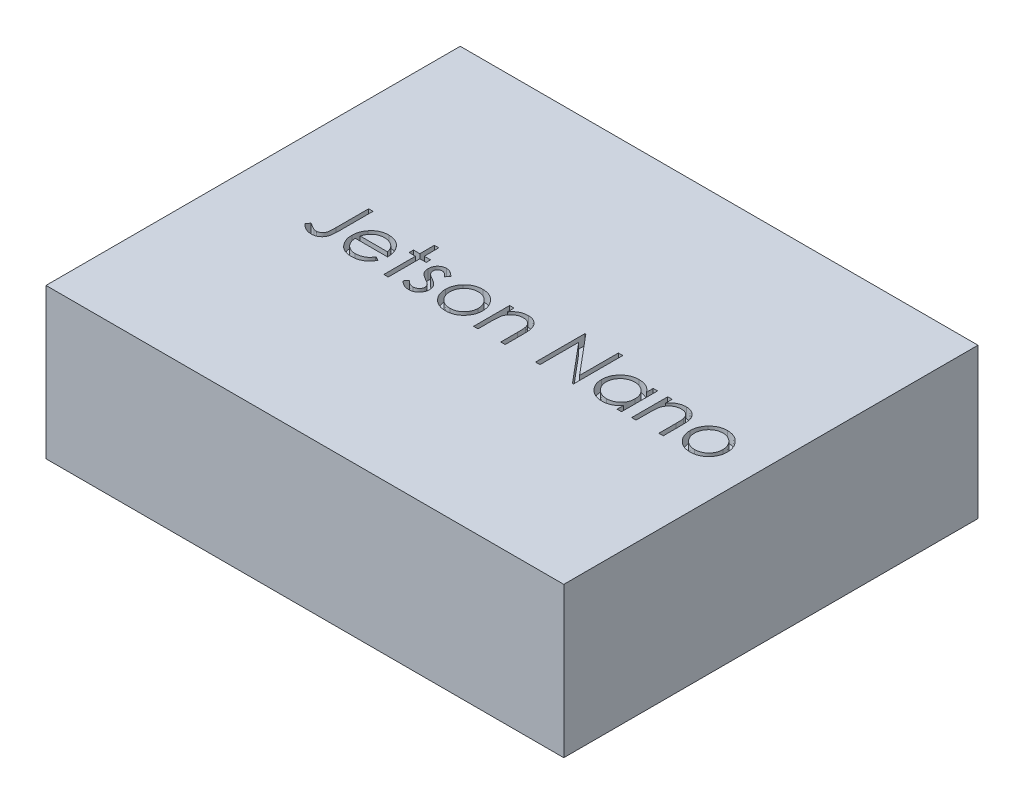
from build123d import *

# Parameters (mm, degrees)
SKETCH1_W           = 100
SKETCH1_H           = 80
BOSS_EXTRUDE1_DEPTH = 29
CUT_EXTRUDE1_DEPTH  = 2


with BuildPart() as part:
    # Sketch1 → Boss-Extrude1 (new body)
    with BuildSketch(Plane(origin=(0, 0, 0), x_dir=(1, 0, 0), z_dir=(0, 1, 0))):
        Rectangle(SKETCH1_W, SKETCH1_H)
    extrude(amount=BOSS_EXTRUDE1_DEPTH)

    # Sketch2 → Cut-Extrude1 (cut)
    # profile 1 of 10: a face of its own
    with BuildSketch(Plane(origin=(0, 29, 0), x_dir=(1, 0, 0), z_dir=(0, 1, 0))):
        with BuildLine():
            Line((-31.665248514, 3.974314492), (-30.810440822, 3.974314492))
            Line((-30.810440822, 3.974314492), (-30.810440822, -2.457731782))
            add(Edge.make_bspline(
                [(-30.810440822, -2.457731782), (-30.811295129, -2.576672283), (-30.812935503, -2.805052558), (-30.821955434, -3.134002232), (-30.838647256, -3.434368171), (-30.862963254, -3.706833373), (-30.895403317, -3.950544255), (-30.9325264, -4.167383922), (-30.977464803, -4.355542629), (-31.045137115, -4.566821705), (-31.156100503, -4.798534487), (-31.323106514, -5.048783862), (-31.530568624, -5.267677643), (-31.770873579, -5.457776845), (-32.046121652, -5.609244024), (-32.350644662, -5.717979188), (-32.682568018, -5.784302734), (-32.912798732, -5.791307432), (-33.031414379, -5.794916277)],
                knots=[0, 0, 0, 0, 1.237770943, 2.376671248, 3.424123796, 4.367912054, 5.222547132, 5.982086412, 6.656319012, 7.234008312, 8.288027371, 9.317870876, 10.352700517, 11.413286737, 12.494591526, 13.606319346, 14.766767577, 16, 16, 16, 16], degree=3))
            add(Edge.make_bspline(
                [(-33.031414379, -5.794916277), (-33.123829626, -5.791975477), (-33.309775222, -5.786058391), (-33.586519223, -5.737830015), (-33.862477457, -5.663491354), (-34.139114614, -5.554627148), (-34.421896192, -5.406566198), (-34.714652093, -5.212841804), (-35.021148063, -4.973814579), (-35.223032577, -4.791376142), (-35.328710052, -4.695877816)],
                knots=[0, 0, 0, 0, 0.848567217, 1.707373443, 2.573483905, 3.470863513, 4.432650262, 5.500696352, 6.691726801, 8, 8, 8, 8], degree=3))
            Line((-35.328710052, -4.695877816), (-34.824984091, -3.963185508))
            add(Edge.make_bspline(
                [(-34.824984091, -3.963185508), (-34.7087718, -4.043324493), (-34.489347842, -4.194637347), (-34.166846471, -4.389291881), (-33.881104219, -4.556183939), (-33.694188483, -4.641234784), (-33.60764635, -4.680613393)],
                knots=[0, 0, 0, 0, 1.196737151, 2.259595785, 3.194191475, 4, 4, 4, 4], degree=3))
            add(Edge.make_bspline(
                [(-33.60764635, -4.680613393), (-33.555165474, -4.701185916), (-33.452238789, -4.741533215), (-33.294871965, -4.786561695), (-33.138403328, -4.811169968), (-33.034668747, -4.815745596), (-32.983713057, -4.8179932)],
                knots=[0, 0, 0, 0, 1.051806502, 2.062826769, 3.048436908, 4, 4, 4, 4], degree=3))
            add(Edge.make_bspline(
                [(-32.983713057, -4.8179932), (-32.917901326, -4.8152099), (-32.787815798, -4.809708342), (-32.5987745, -4.761132814), (-32.417913715, -4.686989118), (-32.251717004, -4.578427811), (-32.098540344, -4.449346588), (-31.972149511, -4.293256307), (-31.866783296, -4.120266022), (-31.803374845, -3.956513708), (-31.762975858, -3.807170879), (-31.737335573, -3.669920702), (-31.714914648, -3.509461249), (-31.695370567, -3.32560099), (-31.683928401, -3.117971823), (-31.67109068, -2.887183405), (-31.666449934, -2.632653873), (-31.665661207, -2.455186925), (-31.665248514, -2.362329138)],
                knots=[0, 0, 0, 0, 0.997221856, 1.971139923, 2.944579524, 3.951425367, 4.971190333, 5.972282193, 6.985401279, 8.033996657, 8.624075553, 9.332086008, 10.151144245, 11.082816738, 12.137127781, 13.306538797, 14.590673636, 16, 16, 16, 16], degree=3))
            Line((-31.665248514, -2.362329138), (-31.665248514, 3.974314492))
        make_face()
    # profile 2 of 10: a face of its own
    with BuildSketch(Plane(origin=(0, 29, 0), x_dir=(1, 0, 0), z_dir=(0, 1, 0))):
        with BuildLine():
            Line((-22.899653562, -3.352608585), (-22.140248514, -3.751391638))
            add(Edge.make_bspline(
                [(-22.140248514, -3.751391638), (-22.20076382, -3.858733846), (-22.31850264, -4.067579276), (-22.520978961, -4.354504554), (-22.733228815, -4.612625837), (-22.964833186, -4.835047254), (-23.208862812, -5.028952809), (-23.466670965, -5.198600746), (-23.739599819, -5.343159005), (-24.027662284, -5.464949813), (-24.333277492, -5.558592793), (-24.657186047, -5.624734994), (-25.000008474, -5.665619747), (-25.234993435, -5.670369023), (-25.355317624, -5.672800893)],
                knots=[0, 0, 0, 0, 1.120438281, 2.179929193, 3.190490725, 4.156257408, 5.095198341, 6.022838206, 6.959905092, 7.901321166, 8.864066838, 9.862729781, 10.905609505, 12, 12, 12, 12], degree=3))
            add(Edge.make_bspline(
                [(-25.355317624, -5.672800893), (-25.489054006, -5.669678937), (-25.749934943, -5.663588906), (-26.129682398, -5.611085842), (-26.487222101, -5.525436066), (-26.822533951, -5.405786985), (-27.134796795, -5.249502624), (-27.424631264, -5.059112892), (-27.693561545, -4.835595827), (-27.933113143, -4.577015363), (-28.14876971, -4.300295179), (-28.339067834, -4.011943808), (-28.498155557, -3.712686747), (-28.627566589, -3.404429107), (-28.732082686, -3.089113796), (-28.804926359, -2.763871874), (-28.846917316, -2.429583605), (-28.853351985, -2.203440142), (-28.856594668, -2.089477575)],
                knots=[0, 0, 0, 0, 1.145258523, 2.234067595, 3.276747158, 4.290159414, 5.277019952, 6.260822364, 7.254936242, 8.264827045, 9.274100331, 10.257902744, 11.220704747, 12.172965371, 13.118907548, 14.062713208, 15.023725156, 16, 16, 16, 16], degree=3))
            add(Edge.make_bspline(
                [(-28.856594668, -2.089477575), (-28.85371229, -1.982539501), (-28.847999799, -1.77060236), (-28.811993156, -1.456915414), (-28.748180301, -1.152037982), (-28.660614734, -0.855716735), (-28.547535985, -0.568447813), (-28.409199732, -0.290056383), (-28.245390475, -0.02083868), (-28.118918413, 0.148986991), (-28.055212456, 0.234530838)],
                knots=[0, 0, 0, 0, 1.024358464, 2.0301432, 3.019427413, 4.004406732, 4.986367066, 5.972626655, 6.978780325, 8, 8, 8, 8], degree=3))
            add(Edge.make_bspline(
                [(-28.055212456, 0.234530838), (-27.968922262, 0.337588263), (-27.799075329, 0.540438516), (-27.511811248, 0.806970674), (-27.200751428, 1.030246947), (-26.869794074, 1.215323511), (-26.515092669, 1.35594965), (-26.141415242, 1.460745285), (-25.744506896, 1.5194683), (-25.47316626, 1.527762762), (-25.334329043, 1.5320068)],
                knots=[0, 0, 0, 0, 1.030682036, 2.02871468, 2.997146059, 3.962720338, 4.930598197, 5.918074684, 6.934738563, 8, 8, 8, 8], degree=3))
            add(Edge.make_bspline(
                [(-25.334329043, 1.5320068), (-25.191596631, 1.528321852), (-24.911588176, 1.521092826), (-24.503286475, 1.454074018), (-24.116950525, 1.347795281), (-23.752734924, 1.197698179), (-23.410602746, 1.004042542), (-23.092777854, 0.764170816), (-22.793824809, 0.485447307), (-22.619902177, 0.271098859), (-22.531399355, 0.162024829)],
                knots=[0, 0, 0, 0, 1.056321875, 2.072262726, 3.055038591, 4.01806755, 4.982017516, 5.957941055, 6.960871419, 8, 8, 8, 8], degree=3))
            add(Edge.make_bspline(
                [(-22.531399355, 0.162024829), (-22.471182473, 0.079827939), (-22.35114953, -0.084018712), (-22.200798494, -0.351184504), (-22.070285869, -0.63070405), (-21.965965454, -0.927095644), (-21.881493668, -1.236847502), (-21.82037904, -1.562173999), (-21.784538864, -1.902978257), (-21.777493909, -2.135188383), (-21.77390236, -2.253570123)],
                knots=[0, 0, 0, 0, 0.94817472, 1.890038105, 2.849395472, 3.817997239, 4.812318967, 5.836947057, 6.897266129, 8, 8, 8, 8], degree=3))
            Line((-21.77390236, -2.253570123), (-28.001786975, -2.253570123))
            add(Edge.make_bspline(
                [(-28.001786975, -2.253570123), (-27.997597047, -2.34528353), (-27.98935772, -2.525634244), (-27.950944366, -2.789533304), (-27.890395918, -3.040920756), (-27.805299397, -3.277911035), (-27.702247483, -3.503599453), (-27.576012068, -3.716311854), (-27.425409424, -3.915079364), (-27.257427343, -4.101679931), (-27.07044589, -4.267852431), (-26.873733557, -4.416583336), (-26.664473212, -4.541239996), (-26.444314856, -4.64242241), (-26.213614498, -4.72163317), (-25.972299453, -4.775702025), (-25.720844579, -4.811916366), (-25.549433403, -4.815943169), (-25.462168586, -4.8179932)],
                knots=[0, 0, 0, 0, 1.094153842, 2.151609401, 3.174256925, 4.172055639, 5.149267565, 6.128595816, 7.11444997, 8.118368179, 9.117203808, 10.09244225, 11.054858984, 12.015122123, 12.976791628, 13.957293641, 14.960065497, 16, 16, 16, 16], degree=3))
            add(Edge.make_bspline(
                [(-25.462168586, -4.8179932), (-25.376848677, -4.816338417), (-25.207557611, -4.813055011), (-24.955442135, -4.781127453), (-24.707412421, -4.729501203), (-24.464495031, -4.659043445), (-24.231620086, -4.573109297), (-24.015958982, -4.469415092), (-23.817620681, -4.354707567), (-23.632245222, -4.223508379), (-23.452437733, -4.062921813), (-23.274068538, -3.862527458), (-23.082815645, -3.625524972), (-22.963101111, -3.447147124), (-22.899653562, -3.352608585)],
                knots=[0, 0, 0, 0, 0.99110716, 1.966546729, 2.947904876, 3.932708344, 4.903319531, 5.828989031, 6.710028674, 7.56322171, 8.463672341, 9.504779593, 10.677557249, 12, 12, 12, 12], degree=3))
        make_face()
        with BuildLine():
            add(Edge.make_bspline(
                [(-22.628710052, -1.398762431), (-22.659997295, -1.285379896), (-22.720215165, -1.067155014), (-22.846044129, -0.764965162), (-22.987753107, -0.496393089), (-23.155452248, -0.263494231), (-23.345458922, -0.056656099), (-23.564929027, 0.124097337), (-23.811043851, 0.285797686), (-24.082531227, 0.422284131), (-24.370027799, 0.538461532), (-24.67103465, 0.61636274), (-24.978169058, 0.669728708), (-25.185907366, 0.674698332), (-25.290443826, 0.677199107)],
                knots=[0, 0, 0, 0, 1.154881502, 2.222775134, 3.210006277, 4.132804581, 5.035138423, 5.962687519, 6.919655026, 7.923214229, 8.944639381, 9.960483929, 10.97369054, 12, 12, 12, 12], degree=3))
            add(Edge.make_bspline(
                [(-25.290443826, 0.677199107), (-25.375759084, 0.675534487), (-25.544409412, 0.672243882), (-25.792878747, 0.641028745), (-26.031492785, 0.589430881), (-26.262012175, 0.518769106), (-26.48141611, 0.424584267), (-26.694217586, 0.314139914), (-26.895005664, 0.179316033), (-27.020575904, 0.076558006), (-27.084013538, 0.024645021)],
                knots=[0, 0, 0, 0, 1.04873581, 2.073130211, 3.073294108, 4.04793562, 5.032784715, 6.005352987, 6.992311501, 8, 8, 8, 8], degree=3))
            add(Edge.make_bspline(
                [(-27.084013538, 0.024645021), (-27.129443112, -0.016433081), (-27.221381499, -0.099565147), (-27.344228204, -0.242791774), (-27.461849633, -0.397237097), (-27.56889336, -0.5688099), (-27.667075934, -0.755556449), (-27.758951301, -0.955901584), (-27.841645751, -1.171365603), (-27.888171593, -1.321513456), (-27.91210849, -1.398762431)],
                knots=[0, 0, 0, 0, 0.879870761, 1.780643979, 2.707998968, 3.669668524, 4.684282772, 5.740141944, 6.837334558, 8, 8, 8, 8], degree=3))
            Line((-27.91210849, -1.398762431), (-22.628710052, -1.398762431))
        make_face(mode=Mode.SUBTRACT)
    # profile 3 of 10: a face of its own
    with BuildSketch(Plane(origin=(0, 29, 0), x_dir=(1, 0, 0), z_dir=(0, 1, 0))):
        Polygon((-19.209479283, 4.218545261), (-18.354671591, 4.218545261), (-18.354671591, 1.409891415), (-17.133517745, 1.409891415), (-17.133517745, 0.555083723), (-18.354671591, 0.555083723), (-18.354671591, -5.550685508), (-19.209479283, -5.550685508), (-19.209479283, 0.555083723), (-20.430633129, 0.555083723), (-20.430633129, 1.409891415), (-19.209479283, 1.409891415), align=None)
    # profile 4 of 10: a face of its own
    with BuildSketch(Plane(origin=(0, 29, 0), x_dir=(1, 0, 0), z_dir=(0, 1, 0))):
        with BuildLine():
            Line((-12.371017745, 0.541727353), (-12.951065822, -0.0554932))
            add(Edge.make_bspline(
                [(-12.951065822, -0.0554932), (-13.001114263, 0.002509005), (-13.097601767, 0.114330429), (-13.250631726, 0.263837731), (-13.403095962, 0.389396115), (-13.552907376, 0.495401905), (-13.703833094, 0.575545654), (-13.854101992, 0.634042386), (-14.003869659, 0.6702423), (-14.103980226, 0.674908022), (-14.153139139, 0.677199107)],
                knots=[0, 0, 0, 0, 1.26578478, 2.440284043, 3.530471711, 4.527705817, 5.468200915, 6.346673037, 7.188140097, 8, 8, 8, 8], degree=3))
            add(Edge.make_bspline(
                [(-14.153139139, 0.677199107), (-14.213389907, 0.674273917), (-14.331954892, 0.668517557), (-14.501842297, 0.611058865), (-14.659550784, 0.522860798), (-14.796049422, 0.397760581), (-14.911676609, 0.254166393), (-14.996078126, 0.093612109), (-15.047692696, -0.07905721), (-15.054237002, -0.198881323), (-15.057556206, -0.259654859)],
                knots=[0, 0, 0, 0, 0.99966794, 1.967205029, 2.953328237, 3.988086729, 5.028030931, 6.008226631, 6.989793394, 8, 8, 8, 8], degree=3))
            add(Edge.make_bspline(
                [(-15.057556206, -0.259654859), (-15.05453321, -0.314660493), (-15.048495739, -0.424516702), (-15.001560134, -0.586572423), (-14.92681318, -0.744570505), (-14.85695358, -0.841352415), (-14.820957649, -0.891220364)],
                knots=[0, 0, 0, 0, 0.960159726, 1.917612774, 2.927026955, 4, 4, 4, 4], degree=3))
            add(Edge.make_bspline(
                [(-14.820957649, -0.891220364), (-14.799285569, -0.917848411), (-14.753159279, -0.974522854), (-14.666594678, -1.053182626), (-14.568562009, -1.140111181), (-14.450669893, -1.227025001), (-14.317997453, -1.318551339), (-14.167667687, -1.411085715), (-14.004451355, -1.511681757), (-13.887600542, -1.575484114), (-13.826862096, -1.608648248)],
                knots=[0, 0, 0, 0, 0.66740084, 1.420478572, 2.27185888, 3.217733974, 4.268547843, 5.408967954, 6.65319498, 8, 8, 8, 8], degree=3))
            add(Edge.make_bspline(
                [(-13.826862096, -1.608648248), (-13.752802289, -1.650136162), (-13.60974313, -1.730277151), (-13.406472099, -1.854672844), (-13.221994509, -1.97831122), (-13.054747299, -2.099870016), (-12.90794852, -2.22275032), (-12.777144273, -2.342242144), (-12.66559715, -2.461955905), (-12.603129678, -2.545593878), (-12.57327135, -2.585571325)],
                knots=[0, 0, 0, 0, 1.27191281, 2.456916733, 3.569705269, 4.599008579, 5.553216877, 6.436649441, 7.252746552, 8, 8, 8, 8], degree=3))
            add(Edge.make_bspline(
                [(-12.57327135, -2.585571325), (-12.523712701, -2.666305465), (-12.42508179, -2.826981387), (-12.321508937, -3.091554393), (-12.261473474, -3.37216226), (-12.253139861, -3.564110659), (-12.24890236, -3.661713152)],
                knots=[0, 0, 0, 0, 0.995354457, 1.980940102, 2.973342416, 4, 4, 4, 4], degree=3))
            add(Edge.make_bspline(
                [(-12.24890236, -3.661713152), (-12.25086052, -3.730481329), (-12.254719288, -3.865996533), (-12.281547313, -4.065572034), (-12.32768907, -4.256438223), (-12.390537072, -4.440666104), (-12.475403115, -4.61472579), (-12.574865335, -4.783008725), (-12.694267773, -4.941874651), (-12.830587874, -5.091114964), (-12.979845968, -5.227419748), (-13.139066245, -5.347227794), (-13.308444776, -5.44676224), (-13.486771286, -5.529127215), (-13.674450945, -5.59462726), (-13.871513096, -5.639973149), (-14.07733135, -5.667113306), (-14.217293899, -5.670881059), (-14.288610894, -5.672800893)],
                knots=[0, 0, 0, 0, 1.032770009, 2.035186124, 3.017557409, 3.978232242, 4.952395191, 5.920591857, 6.910227898, 7.931268572, 8.952309245, 9.941945286, 10.918353717, 11.897095711, 12.887975737, 13.898235213, 14.929059601, 16, 16, 16, 16], degree=3))
            add(Edge.make_bspline(
                [(-14.288610894, -5.672800893), (-14.384860135, -5.670099329), (-14.576021244, -5.664733741), (-14.858749694, -5.614370818), (-15.135031187, -5.53600621), (-15.402774964, -5.427922132), (-15.655993317, -5.291440549), (-15.887671048, -5.127985035), (-16.098612956, -4.942955114), (-16.218677687, -4.80113355), (-16.278710052, -4.730222768)],
                knots=[0, 0, 0, 0, 1.013940152, 2.01379169, 3.017749504, 4.037548394, 5.051665909, 6.043208538, 7.021604269, 8, 8, 8, 8], degree=3))
            Line((-16.278710052, -4.730222768), (-15.712018346, -4.085300893))
            add(Edge.make_bspline(
                [(-15.712018346, -4.085300893), (-15.658209136, -4.143416359), (-15.553891847, -4.256081978), (-15.387064964, -4.406098933), (-15.21730388, -4.531832393), (-15.046303768, -4.636997686), (-14.871533369, -4.718029319), (-14.69397209, -4.774957778), (-14.513981093, -4.811545187), (-14.393089424, -4.815840369), (-14.33249611, -4.8179932)],
                knots=[0, 0, 0, 0, 1.179806542, 2.287233372, 3.337373186, 4.324005949, 5.273901747, 6.200048787, 7.097828587, 8, 8, 8, 8], degree=3))
            add(Edge.make_bspline(
                [(-14.33249611, -4.8179932), (-14.24998804, -4.814262598), (-14.088781112, -4.806973628), (-13.857884883, -4.740796399), (-13.644691907, -4.637028459), (-13.459571231, -4.489840816), (-13.301994635, -4.318511722), (-13.187890104, -4.125524011), (-13.116381369, -3.916541547), (-13.107983044, -3.771673638), (-13.103710052, -3.697966157)],
                knots=[0, 0, 0, 0, 1.072336372, 2.095165389, 3.102688358, 4.141489647, 5.156069229, 6.117746104, 7.042326257, 8, 8, 8, 8], degree=3))
            add(Edge.make_bspline(
                [(-13.103710052, -3.697966157), (-13.106666325, -3.637252123), (-13.112503089, -3.517380391), (-13.158340851, -3.343888392), (-13.230765827, -3.179325563), (-13.302079906, -3.083015166), (-13.338400557, -3.033963753)],
                knots=[0, 0, 0, 0, 1.013901739, 2.00181326, 2.98231254, 4, 4, 4, 4], degree=3))
            add(Edge.make_bspline(
                [(-13.338400557, -3.033963753), (-13.360232931, -3.00937466), (-13.407791725, -2.955810736), (-13.495027774, -2.878453914), (-13.599481271, -2.795074516), (-13.722327, -2.707086406), (-13.863812607, -2.615650201), (-14.024511536, -2.521245607), (-14.202222326, -2.419388725), (-14.327872401, -2.351843805), (-14.393553802, -2.316535868)],
                knots=[0, 0, 0, 0, 0.615000592, 1.339693406, 2.178160186, 3.116406724, 4.166410947, 5.330106347, 6.604359322, 8, 8, 8, 8], degree=3))
            add(Edge.make_bspline(
                [(-14.393553802, -2.316535868), (-14.464437873, -2.27696866), (-14.601904707, -2.200235216), (-14.796615549, -2.08072074), (-14.972276563, -1.959161943), (-15.133114555, -1.842377716), (-15.275067006, -1.724210719), (-15.397574694, -1.60452977), (-15.505460874, -1.488161522), (-15.565189188, -1.405709593), (-15.593719067, -1.366325532)],
                knots=[0, 0, 0, 0, 1.262093308, 2.447601706, 3.550203992, 4.582594899, 5.537233252, 6.418365656, 7.244515135, 8, 8, 8, 8], degree=3))
            add(Edge.make_bspline(
                [(-15.593719067, -1.366325532), (-15.643060199, -1.287007822), (-15.741759705, -1.128344685), (-15.837595333, -0.863521174), (-15.903470311, -0.584724267), (-15.909355102, -0.392355042), (-15.912363899, -0.293999811)],
                knots=[0, 0, 0, 0, 0.985009483, 1.970363186, 2.962279964, 4, 4, 4, 4], degree=3))
            add(Edge.make_bspline(
                [(-15.912363899, -0.293999811), (-15.910910124, -0.229704978), (-15.908064882, -0.10387088), (-15.885357141, 0.081019766), (-15.844013984, 0.256682956), (-15.792157374, 0.425756776), (-15.720085769, 0.584966047), (-15.633963698, 0.736433878), (-15.532760777, 0.879950912), (-15.416165822, 1.013309436), (-15.287968451, 1.134438388), (-15.149461971, 1.240026083), (-15.00376143, 1.330122663), (-14.850249945, 1.405683564), (-14.687452801, 1.462837327), (-14.516507935, 1.502182068), (-14.337761364, 1.528458013), (-14.215566157, 1.530806835), (-14.153139139, 1.5320068)],
                knots=[0, 0, 0, 0, 1.087655834, 2.128696564, 3.144119009, 4.137814668, 5.115653402, 6.093965665, 7.082169637, 8.081268856, 9.086088321, 10.061021666, 11.022561449, 11.980240094, 12.950172527, 13.934149372, 14.944599409, 16, 16, 16, 16], degree=3))
            add(Edge.make_bspline(
                [(-14.153139139, 1.5320068), (-14.07913788, 1.529001415), (-13.929747177, 1.522934269), (-13.705624945, 1.474749497), (-13.481832778, 1.395465835), (-13.257795661, 1.2859658), (-13.035154802, 1.144269516), (-12.811951785, 0.973011923), (-12.585507074, 0.773319714), (-12.444111679, 0.620649679), (-12.371017745, 0.541727353)],
                knots=[0, 0, 0, 0, 0.845714091, 1.707292901, 2.609013841, 3.555613372, 4.552488639, 5.621697636, 6.770543573, 8, 8, 8, 8], degree=3))
        make_face()
    # profile 5 of 10: a face of its own
    with BuildSketch(Plane(origin=(0, 29, 0), x_dir=(1, 0, 0), z_dir=(0, 1, 0))):
        with BuildLine():
            add(Edge.make_bspline(
                [(-7.177297793, 1.5320068), (-7.046692972, 1.529225796), (-6.790608836, 1.523772927), (-6.415574518, 1.465493628), (-6.057583826, 1.376374015), (-5.715265689, 1.253170692), (-5.393004199, 1.088029098), (-5.086105314, 0.890972385), (-4.795410454, 0.657521184), (-4.621176353, 0.47693244), (-4.532736495, 0.385267016)],
                knots=[0, 0, 0, 0, 1.054011418, 2.066658804, 3.057071809, 4.030435133, 4.997543892, 5.974964718, 6.972108034, 8, 8, 8, 8], degree=3))
            add(Edge.make_bspline(
                [(-4.532736495, 0.385267016), (-4.456585605, 0.297598955), (-4.305757556, 0.123959451), (-4.112357279, -0.15758761), (-3.945747176, -0.449161741), (-3.812225832, -0.754634823), (-3.706947303, -1.071340178), (-3.632201373, -1.400366366), (-3.587741571, -1.740986753), (-3.581746354, -1.972318627), (-3.578710052, -2.089477575)],
                knots=[0, 0, 0, 0, 1.025258237, 2.030674902, 3.01204498, 3.988269485, 4.97094183, 5.956517959, 6.965070386, 8, 8, 8, 8], degree=3))
            add(Edge.make_bspline(
                [(-3.578710052, -2.089477575), (-3.581380692, -2.207315589), (-3.586658, -2.440169001), (-3.636578842, -2.783121703), (-3.714224154, -3.115666185), (-3.825345085, -3.436410202), (-3.967833939, -3.746334182), (-4.141707882, -4.044084455), (-4.348187069, -4.330248475), (-4.582240803, -4.602396335), (-4.840917694, -4.853220105), (-5.121540926, -5.071827753), (-5.418595832, -5.259120616), (-5.736032387, -5.409986861), (-6.070951762, -5.528939689), (-6.424076354, -5.61248759), (-6.794857581, -5.663001887), (-7.048024519, -5.669488611), (-7.177297793, -5.672800893)],
                knots=[0, 0, 0, 0, 0.998656419, 1.973391657, 2.932242238, 3.890759089, 4.846373663, 5.82037756, 6.809684879, 7.83454468, 8.860553229, 9.859544525, 10.845671541, 11.83227036, 12.833544569, 13.85385346, 14.904124723, 16, 16, 16, 16], degree=3))
            add(Edge.make_bspline(
                [(-7.177297793, -5.672800893), (-7.307204422, -5.669477494), (-7.561633119, -5.662968451), (-7.933723113, -5.612683846), (-8.287480576, -5.528978193), (-8.622838405, -5.409595945), (-8.941639738, -5.259115794), (-9.240415848, -5.072393981), (-9.521267046, -4.853155273), (-9.779998661, -4.602413902), (-10.014037723, -4.330243949), (-10.220520695, -4.04408563), (-10.394393654, -3.746333876), (-10.536882766, -3.436410283), (-10.648003629, -3.115666163), (-10.725648959, -2.783121709), (-10.775569796, -2.440168999), (-10.780847105, -2.207315589), (-10.783517745, -2.089477575)],
                knots=[0, 0, 0, 0, 1.099876186, 2.154163076, 3.173186993, 4.173200201, 5.163417411, 6.152872554, 7.150605724, 8.17532212, 9.198891216, 10.186952605, 11.159729845, 12.11414092, 13.071450619, 14.029093627, 15.002601286, 16, 16, 16, 16], degree=3))
            add(Edge.make_bspline(
                [(-10.783517745, -2.089477575), (-10.780460736, -1.972955404), (-10.774408384, -1.74226153), (-10.729993284, -1.402281458), (-10.655538927, -1.073812135), (-10.550134198, -0.758329232), (-10.415382142, -0.454194796), (-10.251113209, -0.16190022), (-10.05574013, 0.118373723), (-9.905511962, 0.291788812), (-9.829491302, 0.379542857)],
                knots=[0, 0, 0, 0, 1.031353054, 2.041901799, 3.029428768, 4.008703097, 4.981709435, 5.96992636, 6.972712378, 8, 8, 8, 8], degree=3))
            add(Edge.make_bspline(
                [(-9.829491302, 0.379542857), (-9.74118478, 0.472003228), (-9.567514464, 0.653842815), (-9.27537257, 0.88661347), (-8.969228671, 1.087770786), (-8.643405836, 1.249631058), (-8.301368916, 1.377098738), (-7.941543691, 1.465723461), (-7.565236753, 1.523562949), (-7.307899498, 1.529164133), (-7.177297793, 1.5320068)],
                knots=[0, 0, 0, 0, 1.027980169, 2.021703884, 2.998553061, 3.971491411, 4.943284454, 5.930300938, 6.949603206, 8, 8, 8, 8], degree=3))
        make_face()
        with BuildLine():
            add(Edge.make_bspline(
                [(-7.181113899, 0.677199107), (-7.273472684, 0.67457404), (-7.455806027, 0.669391671), (-7.724192182, 0.629974759), (-7.98256503, 0.567524766), (-8.231414755, 0.478795156), (-8.469902175, 0.364226009), (-8.69825562, 0.2235054), (-8.91714676, 0.05849714), (-9.122293661, -0.130540559), (-9.310568382, -0.337039823), (-9.475154875, -0.557062856), (-9.615104629, -0.787040842), (-9.731691062, -1.027212931), (-9.818524195, -1.280013), (-9.88158792, -1.542578146), (-9.920967646, -1.815443315), (-9.926101291, -2.000938658), (-9.928710052, -2.095201734)],
                knots=[0, 0, 0, 0, 1.021534396, 2.016698045, 2.994645724, 3.958388632, 4.93408049, 5.916473867, 6.921342795, 7.962252576, 8.998418191, 10.008913653, 10.997312074, 11.973003931, 12.956656626, 13.948281152, 14.957379055, 16, 16, 16, 16], degree=3))
            add(Edge.make_bspline(
                [(-9.928710052, -2.095201734), (-9.924337197, -2.216991179), (-9.915657896, -2.458720454), (-9.845077002, -2.814713581), (-9.727004341, -3.156475621), (-9.567563244, -3.482003072), (-9.367793463, -3.783189771), (-9.132425088, -4.051717168), (-8.86398419, -4.283544269), (-8.565670714, -4.475897142), (-8.243577892, -4.628731905), (-7.902701761, -4.737041975), (-7.547172443, -4.807449938), (-7.304201311, -4.814448022), (-7.181113899, -4.8179932)],
                knots=[0, 0, 0, 0, 1.016792936, 2.018143844, 3.017858371, 4.030088057, 5.03801393, 6.028138512, 7.003788237, 7.991172063, 8.984598303, 9.972568034, 10.972917682, 12, 12, 12, 12], degree=3))
            add(Edge.make_bspline(
                [(-7.181113899, -4.8179932), (-7.058033566, -4.814427366), (-6.815076408, -4.807388508), (-6.460041077, -4.737396578), (-6.120096625, -4.62825733), (-5.798338349, -4.47606903), (-5.500160664, -4.282813815), (-5.229789127, -4.053026246), (-4.996430406, -3.782478551), (-4.796858239, -3.481604133), (-4.634806032, -3.156980289), (-4.517286033, -2.814650504), (-4.44653546, -2.458736518), (-4.437879061, -2.216996561), (-4.433517745, -2.095201734)],
                knots=[0, 0, 0, 0, 1.02726834, 2.027799167, 3.010890988, 4.004497153, 4.992059811, 5.971914811, 6.958719428, 7.966827853, 8.981595046, 9.981490638, 10.983022906, 12, 12, 12, 12], degree=3))
            add(Edge.make_bspline(
                [(-4.433517745, -2.095201734), (-4.436125608, -2.000938095), (-4.441257485, -1.815441643), (-4.480650067, -1.542584538), (-4.543666214, -1.27998955), (-4.630674687, -1.027299455), (-4.746754539, -0.786418997), (-4.889403097, -0.557738097), (-5.05331753, -0.336277639), (-5.243864124, -0.131208088), (-5.448796888, 0.058570833), (-5.667776742, 0.223569385), (-5.895791576, 0.363607556), (-6.133586148, 0.479775111), (-6.382467778, 0.566717515), (-6.640478608, 0.630335348), (-6.907719655, 0.669225098), (-7.089399623, 0.674524104), (-7.181113899, 0.677199107)],
                knots=[0, 0, 0, 0, 1.042956736, 2.052379634, 3.044323526, 4.02829302, 5.004299113, 5.996692471, 7.007513377, 8.048758398, 9.090003419, 10.095195979, 11.07790575, 12.047570684, 13.018257071, 13.989683339, 14.985167495, 16, 16, 16, 16], degree=3))
        make_face(mode=Mode.SUBTRACT)
    # profile 6 of 10: a face of its own
    with BuildSketch(Plane(origin=(0, 29, 0), x_dir=(1, 0, 0), z_dir=(0, 1, 0))):
        with BuildLine():
            Line((-1.869094668, 1.409891415), (-1.014286975, 1.409891415))
            Line((-1.014286975, 1.409891415), (-1.014286975, 0.154392617))
            add(Edge.make_bspline(
                [(-1.014286975, 0.154392617), (-0.923016697, 0.268264599), (-0.745903537, 0.489237151), (-0.450943316, 0.779669572), (-0.139220273, 1.01900622), (0.187356608, 1.209788688), (0.529230657, 1.353607006), (0.884317949, 1.457472862), (1.254744399, 1.519752288), (1.506651902, 1.527889986), (1.634090428, 1.5320068)],
                knots=[0, 0, 0, 0, 1.12780773, 2.188550248, 3.19190651, 4.159438251, 5.104880172, 6.052711206, 7.014878035, 8, 8, 8, 8], degree=3))
            add(Edge.make_bspline(
                [(1.634090428, 1.5320068), (1.762897368, 1.527257375), (2.01500362, 1.517961605), (2.38206463, 1.44443761), (2.724892223, 1.318856594), (3.042264014, 1.14682946), (3.328360216, 0.932907557), (3.579615705, 0.683685166), (3.787432828, 0.397020539), (3.926762794, 0.13107395), (4.018544735, -0.104843412), (4.076327025, -0.306900639), (4.125397053, -0.532012179), (4.167937739, -0.779497775), (4.196722594, -1.051091421), (4.219425544, -1.345679783), (4.235696134, -1.663167438), (4.236341675, -1.882750332), (4.236674563, -1.995982984)],
                knots=[0, 0, 0, 0, 1.235846778, 2.418850247, 3.575807741, 4.728682307, 5.871620074, 6.994088408, 8.11269785, 9.256955736, 9.865816715, 10.540099792, 11.271859618, 12.076849838, 12.949306005, 13.892391288, 14.913166135, 16, 16, 16, 16], degree=3))
            Line((4.236674563, -1.995982984), (4.236674563, -5.550685508))
            Line((4.236674563, -5.550685508), (3.381866871, -5.550685508))
            Line((3.381866871, -5.550685508), (3.381866871, -2.276466758))
            add(Edge.make_bspline(
                [(3.381866871, -2.276466758), (3.381341069, -2.181699961), (3.380335299, -2.000427208), (3.377163075, -1.740887223), (3.369516387, -1.505520178), (3.358771336, -1.294888771), (3.343044117, -1.109195258), (3.326653956, -0.948061441), (3.306610698, -0.8116919), (3.288750198, -0.729599783), (3.280740068, -0.692782864)],
                knots=[0, 0, 0, 0, 1.430800155, 2.736877192, 3.918605307, 4.986035426, 5.920637409, 6.731861385, 7.431261377, 8, 8, 8, 8], degree=3))
            add(Edge.make_bspline(
                [(3.280740068, -0.692782864), (3.251823443, -0.58471171), (3.196167886, -0.376708177), (3.058643261, -0.094565831), (2.884977526, 0.145459237), (2.672984093, 0.341883029), (2.42471068, 0.494747949), (2.140846241, 0.600812783), (1.824130084, 0.667151059), (1.601369228, 0.673756325), (1.485262303, 0.677199107)],
                knots=[0, 0, 0, 0, 1.084156227, 2.086665306, 3.027808233, 3.945421172, 4.874247719, 5.839848303, 6.874090471, 8, 8, 8, 8], degree=3))
            add(Edge.make_bspline(
                [(1.485262303, 0.677199107), (1.416498107, 0.675903695), (1.28041554, 0.673340107), (1.078621688, 0.647619074), (0.882885188, 0.605549991), (0.691241619, 0.548757485), (0.507523981, 0.470755167), (0.325829731, 0.382228809), (0.153000609, 0.271879746), (-0.014648636, 0.148896698), (-0.170621349, 0.012609713), (-0.315750613, -0.131202847), (-0.445121939, -0.284352883), (-0.562330263, -0.44437274), (-0.663508251, -0.613460099), (-0.751827012, -0.789983676), (-0.826763438, -0.97417581), (-0.863999909, -1.102015084), (-0.882631326, -1.165979979)],
                knots=[0, 0, 0, 0, 1.023777757, 2.026029729, 3.023749952, 4.003683103, 4.997618607, 5.993177895, 7.010360494, 8.046726602, 9.087585522, 10.09234134, 11.086953743, 12.070360549, 13.043493632, 14.017870808, 15.008233677, 16, 16, 16, 16], degree=3))
            add(Edge.make_bspline(
                [(-0.882631326, -1.165979979), (-0.893352799, -1.212938782), (-0.916692883, -1.315165638), (-0.941901965, -1.482926523), (-0.964782581, -1.676991526), (-0.983933161, -1.897134189), (-0.995650045, -2.144125263), (-1.00842551, -2.416909936), (-1.013076598, -2.716575929), (-1.013872218, -2.92520525), (-1.014286975, -3.033963753)],
                knots=[0, 0, 0, 0, 0.615963638, 1.340920617, 2.168419149, 3.115676021, 4.16674242, 5.331190069, 6.6087489, 8, 8, 8, 8], degree=3))
            Line((-1.014286975, -3.033963753), (-1.014286975, -5.550685508))
            Line((-1.014286975, -5.550685508), (-1.869094668, -5.550685508))
            Line((-1.869094668, -5.550685508), (-1.869094668, 1.409891415))
        make_face()
    # profile 7 of 10: a face of its own
    with BuildSketch(Plane(origin=(0, 29, 0), x_dir=(1, 0, 0), z_dir=(0, 1, 0))):
        Polygon((10.098213025, -5.550685508), (10.098213025, 3.974314492), (10.277569996, 3.974314492), (16.570328409, -3.522425292), (16.570328409, 3.974314492), (17.425136101, 3.974314492), (17.425136101, -5.550685508), (17.230514707, -5.550685508), (10.953020717, 1.9288818), (10.953020717, -5.550685508), align=None)
    # profile 8 of 10: a face of its own
    with BuildSketch(Plane(origin=(0, 29, 0), x_dir=(1, 0, 0), z_dir=(0, 1, 0))):
        with BuildLine():
            Line((26.705905332, 1.409891415), (26.705905332, -5.550685508))
            Line((26.705905332, -5.550685508), (25.85109764, -5.550685508))
            Line((25.85109764, -5.550685508), (25.85109764, -4.346704138))
            add(Edge.make_bspline(
                [(25.85109764, -4.346704138), (25.754707931, -4.455669033), (25.566602202, -4.668315395), (25.252437446, -4.946124736), (24.91942119, -5.175754311), (24.569169738, -5.361219439), (24.201999375, -5.500534964), (23.818724024, -5.599557297), (23.419187337, -5.663221948), (23.146357714, -5.669579265), (23.008098842, -5.672800893)],
                knots=[0, 0, 0, 0, 1.074387032, 2.096679803, 3.090159297, 4.057316773, 5.018401886, 5.985159533, 6.978961417, 8, 8, 8, 8], degree=3))
            add(Edge.make_bspline(
                [(23.008098842, -5.672800893), (22.885177482, -5.669463408), (22.642771117, -5.662881741), (22.286184843, -5.611821472), (21.943033793, -5.529823137), (21.612993706, -5.415792859), (21.298200224, -5.264533623), (20.995958104, -5.08344637), (20.707833135, -4.867798111), (20.438217018, -4.621269262), (20.189935646, -4.353494333), (19.972054611, -4.067892523), (19.790390872, -3.765698824), (19.63848051, -3.450739313), (19.521469029, -3.120589425), (19.439897925, -2.776390846), (19.388897138, -2.418550547), (19.382318191, -2.174875131), (19.378982255, -2.051316518)],
                knots=[0, 0, 0, 0, 1.033919861, 2.038935746, 3.024066025, 3.998881131, 4.97069526, 5.957263378, 6.95902576, 7.993208707, 9.027059324, 10.027763471, 11.009749337, 11.988697705, 12.965288445, 13.950418724, 14.960734635, 16, 16, 16, 16], degree=3))
            add(Edge.make_bspline(
                [(19.378982255, -2.051316518), (19.382392127, -1.930311724), (19.389133261, -1.691091776), (19.43935238, -1.339269033), (19.523801054, -1.000401481), (19.642313411, -0.675580085), (19.794283303, -0.364411806), (19.979144739, -0.066676567), (20.196911072, 0.218445865), (20.447969408, 0.484251132), (20.719934747, 0.72978009), (21.010879221, 0.943164706), (21.313565437, 1.127451273), (21.632688344, 1.273465377), (21.963524537, 1.391600154), (22.309019271, 1.473332732), (22.667735067, 1.521494727), (22.911277049, 1.528469107), (23.034811582, 1.5320068)],
                knots=[0, 0, 0, 0, 1.020392517, 2.01726096, 2.990465484, 3.961182959, 4.928053699, 5.906110375, 6.912531644, 7.948652711, 8.985773172, 9.998621852, 10.987621588, 11.969261332, 12.953316658, 13.946091881, 14.958173133, 16, 16, 16, 16], degree=3))
            add(Edge.make_bspline(
                [(23.034811582, 1.5320068), (23.17686977, 1.528094062), (23.455439172, 1.520421367), (23.862913254, 1.45656923), (24.248388583, 1.348695973), (24.614840784, 1.201963354), (24.960953937, 1.006976455), (25.283451345, 0.761013847), (25.585708124, 0.46562676), (25.760914489, 0.23874005), (25.85109764, 0.121955718)],
                knots=[0, 0, 0, 0, 1.038897134, 2.037228247, 3.008116434, 3.962042015, 4.918381754, 5.904844433, 6.921570401, 8, 8, 8, 8], degree=3))
            Line((25.85109764, 0.121955718), (25.85109764, 1.409891415))
            Line((25.85109764, 1.409891415), (26.705905332, 1.409891415))
        make_face()
        with BuildLine():
            add(Edge.make_bspline(
                [(23.0462599, 0.677199107), (22.921307309, 0.672753279), (22.674670769, 0.663977921), (22.31260102, 0.595470052), (21.966126658, 0.48148412), (21.636980556, 0.325595518), (21.330362052, 0.129574456), (21.056331419, -0.107520166), (20.812647353, -0.379219469), (20.607701291, -0.684297355), (20.440631439, -1.011353445), (20.323155445, -1.353231381), (20.245678421, -1.703764927), (20.237763091, -1.941516236), (20.233789948, -2.060856782)],
                knots=[0, 0, 0, 0, 1.031046209, 2.035121221, 3.029706178, 4.034933723, 5.034054252, 6.02443088, 7.017295772, 8.038157696, 9.050218397, 10.03989886, 11.016116709, 12, 12, 12, 12], degree=3))
            add(Edge.make_bspline(
                [(20.233789948, -2.060856782), (20.238865122, -2.179484145), (20.248995576, -2.416273892), (20.321795681, -2.767285319), (20.44393305, -3.109243819), (20.61059895, -3.439246951), (20.819296121, -3.745636539), (21.06120024, -4.022515015), (21.338650648, -4.26061168), (21.645974793, -4.459922506), (21.974200769, -4.620929081), (22.319370254, -4.732958428), (22.674994669, -4.80528796), (22.916799949, -4.813736572), (23.038627688, -4.8179932)],
                knots=[0, 0, 0, 0, 0.979072187, 1.954306742, 2.945804271, 3.96968567, 4.997920485, 5.998718438, 6.996577872, 8.005894225, 9.015743152, 10.005417472, 10.995077863, 12, 12, 12, 12], degree=3))
            add(Edge.make_bspline(
                [(23.038627688, -4.8179932), (23.162307099, -4.813475727), (23.408293181, -4.804490921), (23.771437093, -4.735689763), (24.123848385, -4.622018962), (24.460726485, -4.464450624), (24.774551099, -4.269168105), (25.05621318, -4.040548808), (25.294381637, -3.774656571), (25.496291524, -3.482439224), (25.654611766, -3.162094433), (25.769935184, -2.821006386), (25.838117599, -2.459163207), (25.846711135, -2.21188352), (25.85109764, -2.085661469)],
                knots=[0, 0, 0, 0, 1.01762866, 2.023962475, 3.030623092, 4.058876274, 5.077231937, 6.066672613, 7.034107872, 8.005628644, 8.981990164, 9.965428785, 10.961468474, 12, 12, 12, 12], degree=3))
            add(Edge.make_bspline(
                [(25.85109764, -2.085661469), (25.848486004, -1.989492088), (25.843345477, -1.800200311), (25.804073713, -1.522267567), (25.74160352, -1.256292213), (25.653575729, -1.001994609), (25.537938734, -0.760780746), (25.398471599, -0.530918655), (25.232721768, -0.313603844), (25.043357431, -0.111828773), (24.836079273, 0.072211814), (24.616746987, 0.236488783), (24.382761968, 0.371441086), (24.138059175, 0.483131975), (23.882214043, 0.572011519), (23.613144714, 0.631305171), (23.333711185, 0.672018616), (23.143085849, 0.675454095), (23.0462599, 0.677199107)],
                knots=[0, 0, 0, 0, 1.050140795, 2.067009409, 3.05949893, 4.030605086, 5.00011959, 5.97591094, 6.962425594, 7.979863591, 8.993523472, 9.986985069, 10.967611495, 11.937549037, 12.921786183, 13.919465291, 14.943216303, 16, 16, 16, 16], degree=3))
        make_face(mode=Mode.SUBTRACT)
    # profile 9 of 10: a face of its own
    with BuildSketch(Plane(origin=(0, 29, 0), x_dir=(1, 0, 0), z_dir=(0, 1, 0))):
        with BuildLine():
            Line((28.659751486, 1.409891415), (29.514559178, 1.409891415))
            Line((29.514559178, 1.409891415), (29.514559178, 0.154392617))
            add(Edge.make_bspline(
                [(29.514559178, 0.154392617), (29.605829457, 0.268264599), (29.782942617, 0.489237151), (30.077902838, 0.779669572), (30.389625881, 1.01900622), (30.716202762, 1.209788688), (31.058076811, 1.353607006), (31.413164102, 1.457472862), (31.783590553, 1.519752288), (32.035498056, 1.527889986), (32.162936582, 1.5320068)],
                knots=[0, 0, 0, 0, 1.12780773, 2.188550248, 3.19190651, 4.159438251, 5.104880172, 6.052711206, 7.014878035, 8, 8, 8, 8], degree=3))
            add(Edge.make_bspline(
                [(32.162936582, 1.5320068), (32.291743522, 1.527257375), (32.543849774, 1.517961605), (32.910910784, 1.44443761), (33.253738377, 1.318856594), (33.571110168, 1.14682946), (33.85720637, 0.932907557), (34.108461858, 0.683685166), (34.316278982, 0.397020539), (34.455608948, 0.13107395), (34.547390889, -0.104843412), (34.605173179, -0.306900639), (34.654243207, -0.532012179), (34.696783893, -0.779497775), (34.725568747, -1.051091421), (34.748271698, -1.345679783), (34.764542287, -1.663167438), (34.765187829, -1.882750332), (34.765520717, -1.995982984)],
                knots=[0, 0, 0, 0, 1.235846778, 2.418850247, 3.575807741, 4.728682307, 5.871620074, 6.994088408, 8.11269785, 9.256955736, 9.865816715, 10.540099792, 11.271859618, 12.076849838, 12.949306005, 13.892391288, 14.913166135, 16, 16, 16, 16], degree=3))
            Line((34.765520717, -1.995982984), (34.765520717, -5.550685508))
            Line((34.765520717, -5.550685508), (33.910713025, -5.550685508))
            Line((33.910713025, -5.550685508), (33.910713025, -2.276466758))
            add(Edge.make_bspline(
                [(33.910713025, -2.276466758), (33.910187223, -2.181699961), (33.909181453, -2.000427208), (33.906009229, -1.740887223), (33.898362541, -1.505520178), (33.88761749, -1.294888771), (33.871890271, -1.109195258), (33.85550011, -0.948061441), (33.835456851, -0.8116919), (33.817596352, -0.729599783), (33.809586222, -0.692782864)],
                knots=[0, 0, 0, 0, 1.430800155, 2.736877192, 3.918605307, 4.986035426, 5.920637409, 6.731861385, 7.431261377, 8, 8, 8, 8], degree=3))
            add(Edge.make_bspline(
                [(33.809586222, -0.692782864), (33.780669597, -0.58471171), (33.72501404, -0.376708177), (33.587489415, -0.094565831), (33.41382368, 0.145459237), (33.201830247, 0.341883029), (32.953556834, 0.494747949), (32.669692395, 0.600812783), (32.352976237, 0.667151059), (32.130215382, 0.673756325), (32.014108457, 0.677199107)],
                knots=[0, 0, 0, 0, 1.084156227, 2.086665306, 3.027808233, 3.945421172, 4.874247719, 5.839848303, 6.874090471, 8, 8, 8, 8], degree=3))
            add(Edge.make_bspline(
                [(32.014108457, 0.677199107), (31.945344261, 0.675903695), (31.809261694, 0.673340107), (31.607467842, 0.647619074), (31.411731342, 0.605549991), (31.220087773, 0.548757485), (31.036370134, 0.470755167), (30.854675885, 0.382228809), (30.681846762, 0.271879746), (30.514197517, 0.148896698), (30.358224805, 0.012609713), (30.213095541, -0.131202847), (30.083724215, -0.284352883), (29.966515891, -0.44437274), (29.865337903, -0.613460099), (29.777019142, -0.789983676), (29.702082715, -0.97417581), (29.664846245, -1.102015084), (29.646214827, -1.165979979)],
                knots=[0, 0, 0, 0, 1.023777757, 2.026029729, 3.023749952, 4.003683103, 4.997618607, 5.993177895, 7.010360494, 8.046726602, 9.087585522, 10.09234134, 11.086953743, 12.070360549, 13.043493632, 14.017870808, 15.008233677, 16, 16, 16, 16], degree=3))
            add(Edge.make_bspline(
                [(29.646214827, -1.165979979), (29.635493355, -1.212938782), (29.612153271, -1.315165638), (29.586944189, -1.482926523), (29.564063573, -1.676991526), (29.544912993, -1.897134189), (29.533196109, -2.144125263), (29.520420644, -2.416909936), (29.515769556, -2.716575929), (29.514973936, -2.92520525), (29.514559178, -3.033963753)],
                knots=[0, 0, 0, 0, 0.615963638, 1.340920617, 2.168419149, 3.115676021, 4.16674242, 5.331190069, 6.6087489, 8, 8, 8, 8], degree=3))
            Line((29.514559178, -3.033963753), (29.514559178, -5.550685508))
            Line((29.514559178, -5.550685508), (28.659751486, -5.550685508))
            Line((28.659751486, -5.550685508), (28.659751486, 1.409891415))
        make_face()
    # profile 10 of 10: a face of its own
    with BuildSketch(Plane(origin=(0, 29, 0), x_dir=(1, 0, 0), z_dir=(0, 1, 0))):
        with BuildLine():
            add(Edge.make_bspline(
                [(40.081356053, 1.5320068), (40.211960875, 1.529225796), (40.46804501, 1.523772927), (40.843079328, 1.465493628), (41.20107002, 1.376374015), (41.543388157, 1.253170692), (41.865649647, 1.088029098), (42.172548533, 0.890972385), (42.463243392, 0.657521184), (42.637477494, 0.47693244), (42.725917351, 0.385267016)],
                knots=[0, 0, 0, 0, 1.054011418, 2.066658804, 3.057071809, 4.030435133, 4.997543892, 5.974964718, 6.972108034, 8, 8, 8, 8], degree=3))
            add(Edge.make_bspline(
                [(42.725917351, 0.385267016), (42.802068241, 0.297598955), (42.95289629, 0.123959451), (43.146296567, -0.15758761), (43.31290667, -0.449161741), (43.446428014, -0.754634823), (43.551706543, -1.071340178), (43.626452473, -1.400366366), (43.670912275, -1.740986753), (43.676907492, -1.972318627), (43.679943794, -2.089477575)],
                knots=[0, 0, 0, 0, 1.025258237, 2.030674902, 3.01204498, 3.988269485, 4.97094183, 5.956517959, 6.965070386, 8, 8, 8, 8], degree=3))
            add(Edge.make_bspline(
                [(43.679943794, -2.089477575), (43.677273154, -2.207315589), (43.671995846, -2.440169001), (43.622075005, -2.783121703), (43.544429692, -3.115666185), (43.433308761, -3.436410202), (43.290819907, -3.746334182), (43.116945964, -4.044084455), (42.910466778, -4.330248475), (42.676413044, -4.602396335), (42.417736152, -4.853220105), (42.13711292, -5.071827753), (41.840058014, -5.259120616), (41.522621459, -5.409986861), (41.187702085, -5.528939689), (40.834577492, -5.61248759), (40.463796265, -5.663001887), (40.210629327, -5.669488611), (40.081356053, -5.672800893)],
                knots=[0, 0, 0, 0, 0.998656419, 1.973391657, 2.932242238, 3.890759089, 4.846373663, 5.82037756, 6.809684879, 7.83454468, 8.860553229, 9.859544525, 10.845671541, 11.83227036, 12.833544569, 13.85385346, 14.904124723, 16, 16, 16, 16], degree=3))
            add(Edge.make_bspline(
                [(40.081356053, -5.672800893), (39.951449424, -5.669477494), (39.697020727, -5.662968451), (39.324930733, -5.612683846), (38.97117327, -5.528978193), (38.635815442, -5.409595945), (38.317014108, -5.259115794), (38.018237999, -5.072393981), (37.7373868, -4.853155273), (37.478655185, -4.602413902), (37.244616124, -4.330243949), (37.038133151, -4.04408563), (36.864260192, -3.746333876), (36.72177108, -3.436410283), (36.610650217, -3.115666163), (36.533004887, -2.783121709), (36.48308405, -2.440168999), (36.477806741, -2.207315589), (36.475136101, -2.089477575)],
                knots=[0, 0, 0, 0, 1.099876186, 2.154163076, 3.173186993, 4.173200201, 5.163417411, 6.152872554, 7.150605724, 8.17532212, 9.198891216, 10.186952605, 11.159729845, 12.11414092, 13.071450619, 14.029093627, 15.002601286, 16, 16, 16, 16], degree=3))
            add(Edge.make_bspline(
                [(36.475136101, -2.089477575), (36.47819311, -1.972955404), (36.484245463, -1.74226153), (36.528660562, -1.402281458), (36.60311492, -1.073812135), (36.708519649, -0.758329232), (36.843271704, -0.454194796), (37.007540637, -0.16190022), (37.202913716, 0.118373723), (37.353141884, 0.291788812), (37.429162544, 0.379542857)],
                knots=[0, 0, 0, 0, 1.031353054, 2.041901799, 3.029428768, 4.008703097, 4.981709435, 5.96992636, 6.972712378, 8, 8, 8, 8], degree=3))
            add(Edge.make_bspline(
                [(37.429162544, 0.379542857), (37.517469067, 0.472003228), (37.691139382, 0.653842815), (37.983281276, 0.88661347), (38.289425175, 1.087770786), (38.61524801, 1.249631058), (38.957284931, 1.377098738), (39.317110155, 1.465723461), (39.693417093, 1.523562949), (39.950754348, 1.529164133), (40.081356053, 1.5320068)],
                knots=[0, 0, 0, 0, 1.027980169, 2.021703884, 2.998553061, 3.971491411, 4.943284454, 5.930300938, 6.949603206, 8, 8, 8, 8], degree=3))
        make_face()
        with BuildLine():
            add(Edge.make_bspline(
                [(40.077539948, 0.677199107), (39.985181163, 0.67457404), (39.80284782, 0.669391671), (39.534461664, 0.629974759), (39.276088817, 0.567524766), (39.027239091, 0.478795156), (38.788751671, 0.364226009), (38.560398226, 0.2235054), (38.341507086, 0.05849714), (38.136360185, -0.130540559), (37.948085464, -0.337039823), (37.783498971, -0.557062856), (37.643549217, -0.787040842), (37.526962785, -1.027212931), (37.440129651, -1.280013), (37.377065926, -1.542578146), (37.3376862, -1.815443315), (37.332552555, -2.000938658), (37.329943794, -2.095201734)],
                knots=[0, 0, 0, 0, 1.021534396, 2.016698045, 2.994645724, 3.958388632, 4.93408049, 5.916473867, 6.921342795, 7.962252576, 8.998418191, 10.008913653, 10.997312074, 11.973003931, 12.956656626, 13.948281152, 14.957379055, 16, 16, 16, 16], degree=3))
            add(Edge.make_bspline(
                [(37.329943794, -2.095201734), (37.33431665, -2.216991179), (37.342995951, -2.458720454), (37.413576844, -2.814713581), (37.531649506, -3.156475621), (37.691090603, -3.482003072), (37.890860383, -3.783189771), (38.126228758, -4.051717168), (38.394669657, -4.283544269), (38.692983132, -4.475897142), (39.015075954, -4.628731905), (39.355952085, -4.737041975), (39.711481403, -4.807449938), (39.954452535, -4.814448022), (40.077539948, -4.8179932)],
                knots=[0, 0, 0, 0, 1.016792936, 2.018143844, 3.017858371, 4.030088057, 5.03801393, 6.028138512, 7.003788237, 7.991172063, 8.984598303, 9.972568034, 10.972917682, 12, 12, 12, 12], degree=3))
            add(Edge.make_bspline(
                [(40.077539948, -4.8179932), (40.20062028, -4.814427366), (40.443577438, -4.807388508), (40.798612769, -4.737396578), (41.138557221, -4.62825733), (41.460315497, -4.47606903), (41.758493182, -4.282813815), (42.02886472, -4.053026246), (42.26222344, -3.782478551), (42.461795607, -3.481604133), (42.623847814, -3.156980289), (42.741367814, -2.814650504), (42.812118387, -2.458736518), (42.820774785, -2.216996561), (42.825136101, -2.095201734)],
                knots=[0, 0, 0, 0, 1.02726834, 2.027799167, 3.010890988, 4.004497153, 4.992059811, 5.971914811, 6.958719428, 7.966827853, 8.981595046, 9.981490638, 10.983022906, 12, 12, 12, 12], degree=3))
            add(Edge.make_bspline(
                [(42.825136101, -2.095201734), (42.822528238, -2.000938095), (42.817396361, -1.815441643), (42.778003779, -1.542584538), (42.714987632, -1.27998955), (42.627979159, -1.027299455), (42.511899307, -0.786418997), (42.369250749, -0.557738097), (42.205336316, -0.336277639), (42.014789722, -0.131208088), (41.809856958, 0.058570833), (41.590877104, 0.223569385), (41.36286227, 0.363607556), (41.125067698, 0.479775111), (40.876186068, 0.566717515), (40.618175238, 0.630335348), (40.350934191, 0.669225098), (40.169254223, 0.674524104), (40.077539948, 0.677199107)],
                knots=[0, 0, 0, 0, 1.042956736, 2.052379634, 3.044323526, 4.02829302, 5.004299113, 5.996692471, 7.007513377, 8.048758398, 9.090003419, 10.095195979, 11.07790575, 12.047570684, 13.018257071, 13.989683339, 14.985167495, 16, 16, 16, 16], degree=3))
        make_face(mode=Mode.SUBTRACT)
    extrude(amount=-CUT_EXTRUDE1_DEPTH, mode=Mode.SUBTRACT)


solid = part.part
